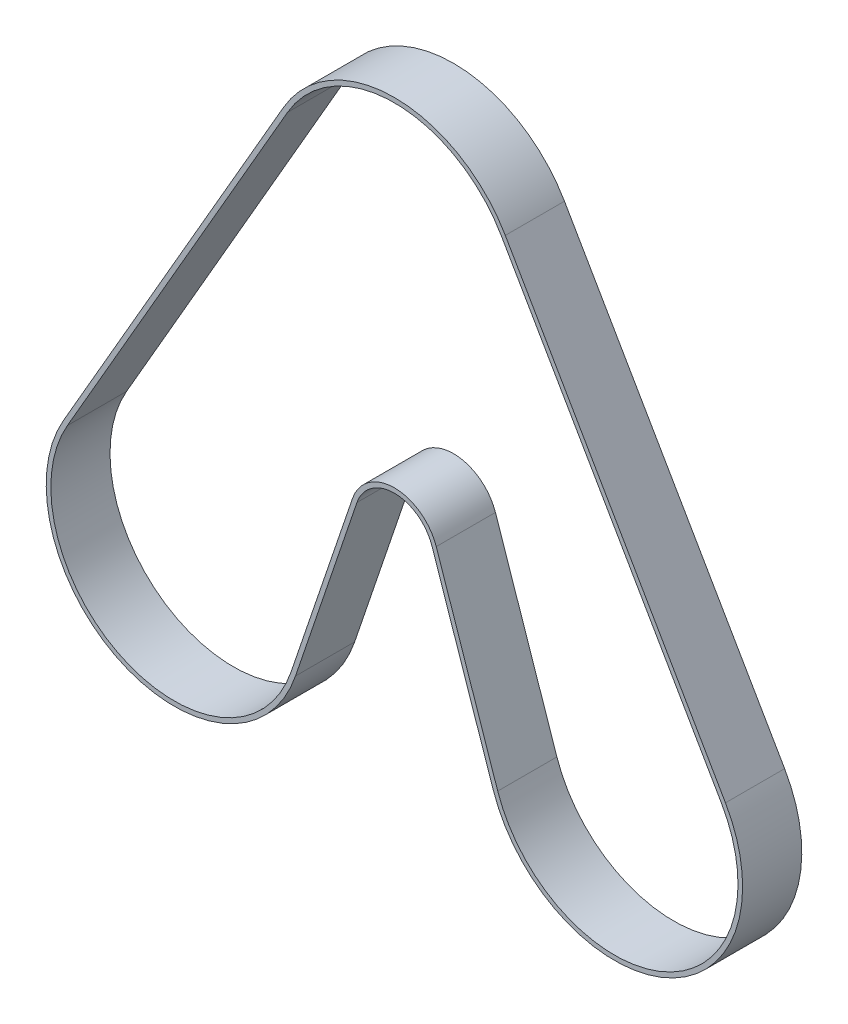
from build123d import *

# Parameters (mm, degrees)
EXTRUDE_THIN1_DEPTH = 3.2


with BuildPart() as part:
    # Sketch1 → Extrude-Thin1 (new, symmetric)
    with BuildSketch(Plane.XY):
        with BuildLine():
            Line((-4.0527272, 1.376154875), (-10.701149136, -18.203211452))
            ThreePointArc((-10.701149136, -18.203211452), (-29.532304121, -26.365186141), (-35.810150446, -6.825))
            Line((-35.810150446, -6.825), (-11.994451842, 34.425))
            ThreePointArc((-11.994451842, 34.425), (0, 41.35), (11.994451842, 34.425))
            Line((11.994451842, 34.425), (35.810150446, -6.825))
            ThreePointArc((35.810150446, -6.825), (29.532304121, -26.365186141), (10.701149136, -18.203211452))
            Line((10.701149136, -18.203211452), (4.0527272, 1.376154875))
            ThreePointArc((4.0527272, 1.376154875), (0, 4.28), (-4.0527272, 1.376154875))
        make_face()
        with BuildLine():
            Line((-4.52617664, 1.536920631), (-11.174598575, -18.042445696))
            ThreePointArc((-11.174598575, -18.042445696), (-29.325928471, -25.909764258), (-35.377137745, -7.075))
            Line((-35.377137745, -7.075), (-11.561439141, 34.175))
            ThreePointArc((-11.561439141, 34.175), (0, 40.85), (11.561439141, 34.175))
            Line((11.561439141, 34.175), (35.377137745, -7.075))
            ThreePointArc((35.377137745, -7.075), (29.325928471, -25.909764258), (11.174598575, -18.042445696))
            Line((11.174598575, -18.042445696), (4.52617664, 1.536920631))
            ThreePointArc((4.52617664, 1.536920631), (0, 4.78), (-4.52617664, 1.536920631))
        make_face(mode=Mode.SUBTRACT)
    extrude(amount=EXTRUDE_THIN1_DEPTH, both=True)


solid = part.part
